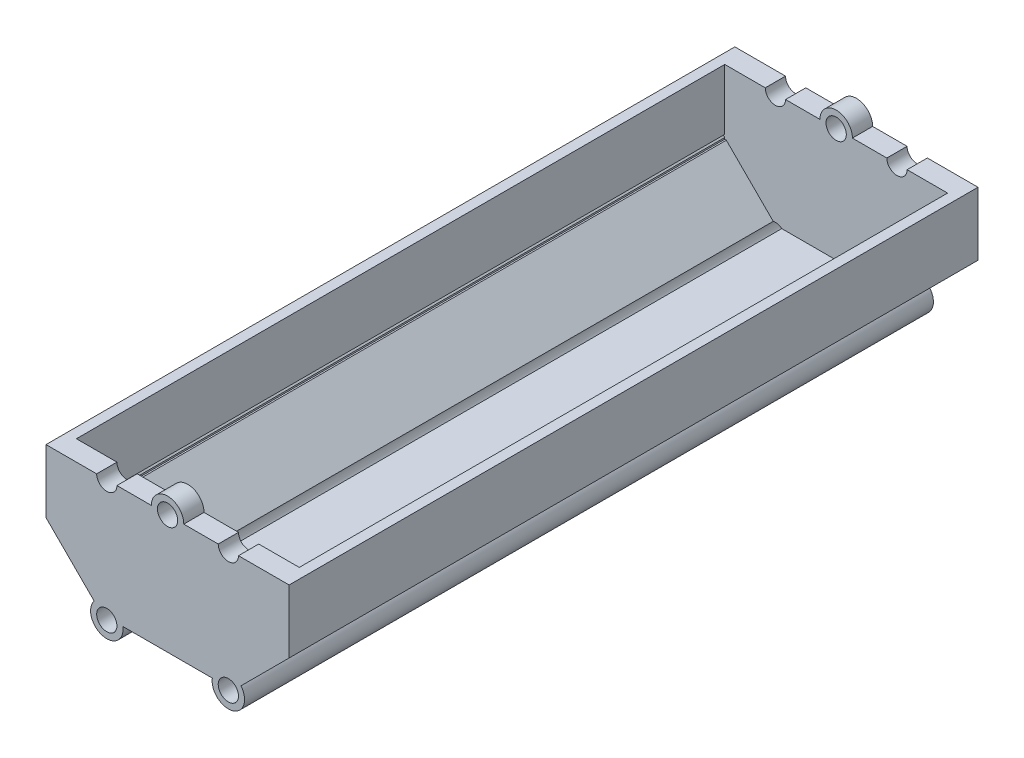
from build123d import *

# Parameters (mm, degrees)
SKETCH1_R               = 6.35
BOSS_EXTRUDE1_DEPTH     = 431.8
CUT_EXTRUDE1_DEPTH      = 12.7
CUT_EXTRUDE1_DEPTH_BACK = 40.64
SKETCH2_W               = 139.7
SKETCH2_H               = 406.4
CUT_EXTRUDE2_START      = -12.7
CUT_EXTRUDE2_DEPTH      = 406.4


with BuildPart() as part:
    # Sketch1 → Boss-Extrude1 (new body)
    with BuildSketch(Plane.XY):
        with BuildLine():
            Line((-61.221298715, -5.681163946), (-61.221298715, 33.973927789))
            Line((-61.221298715, 33.973927789), (-29.471298715, 33.973927789))
            ThreePointArc((-29.471298715, 33.973927789), (-23.121298715, 27.623927789), (-16.771298715, 33.973927789))
            Line((-16.771298715, 33.973927789), (4.818701285, 33.973927789))
            ThreePointArc((4.818701285, 33.973927789), (14.978701285, 44.133927789), (25.138701285, 33.973927789))
            Line((25.138701285, 33.973927789), (46.728701285, 33.973927789))
            ThreePointArc((46.728701285, 33.973927789), (53.078701285, 27.623927789), (59.428701285, 33.973927789))
            Line((59.428701285, 33.973927789), (91.178701285, 33.973927789))
            Line((91.178701285, 33.973927789), (91.178701285, -5.681163946))
            Line((91.178701285, -5.681163946), (60.998251243, -35.861613988))
            ThreePointArc((60.998251243, -35.861613988), (55.706795467, -52.040282366), (43.038417937, -40.670980475))
            Line((43.038417937, -40.670980475), (-13.081015368, -40.670980475))
            ThreePointArc((-13.081015368, -40.670980475), (-25.749392897, -52.040282366), (-31.040848673, -35.861613988))
            Line((-31.040848673, -35.861613988), (-61.221298715, -5.681163946))
        make_face()
        with Locations((14.978701285, 33.973927789)):
            Circle(SKETCH1_R, mode=Mode.SUBTRACT)
        with Locations((53.078701285, -42.226072211)):
            Circle(SKETCH1_R, mode=Mode.SUBTRACT)
        with Locations((-23.121298715, -42.226072211)):
            Circle(SKETCH1_R, mode=Mode.SUBTRACT)
    extrude(amount=BOSS_EXTRUDE1_DEPTH)

    # Sketch2 → Cut-Extrude1 (cut, two sides: drawn at the far end of the back side and taken through both)
    with BuildSketch(Plane(origin=(0, 33.973927789, 0), x_dir=(1, 0, 0), z_dir=(0, 1, 0)).offset(-CUT_EXTRUDE1_DEPTH_BACK)):
        with Locations((14.978701285, -215.9)):
            Rectangle(SKETCH2_W, SKETCH2_H)
    extrude(amount=CUT_EXTRUDE1_DEPTH + CUT_EXTRUDE1_DEPTH_BACK, mode=Mode.SUBTRACT)

    # Sketch3 → Cut-Extrude2 (cut)
    with BuildSketch(Plane(origin=(0, 0, 0), x_dir=(-1, 0, 0), z_dir=(0, 0, -1)).offset(CUT_EXTRUDE2_START)):
        Polygon((-85.778082442, -4.007478335), (56.550022931, -4.007478335), (23.202132139, -37.296656509), (-53.066680528, -37.296656509), align=None)
    extrude(amount=-CUT_EXTRUDE2_DEPTH, mode=Mode.SUBTRACT)


solid = part.part
